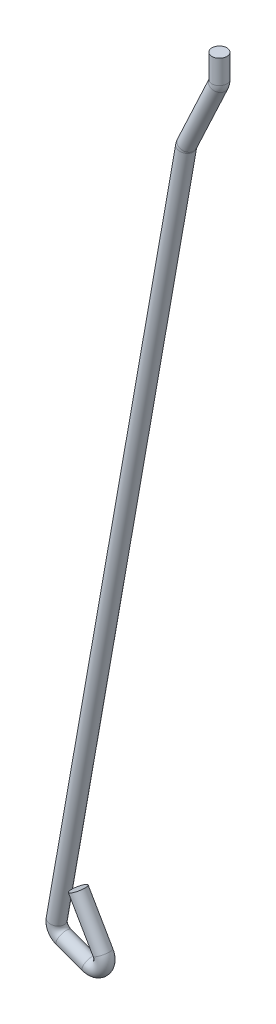
from build123d import *

# Parameters (mm, degrees)
SKETCH2_R = 0.9144


with BuildPart() as part:
    # Sweep3: sweep along a path in Sketch1
    with BuildLine(Plane.XY) as sweep3_path:
        Line((0, 0), (0, -2.893447778))
        ThreePointArc((0, -2.893447778), (-0.030104071, -3.168326088), (-0.11898911, -3.430172971))
        Line((-0.11898911, -3.430172971), (-3.954777731, -11.656048213))
        ThreePointArc((-3.954777731, -11.656048213), (-4.014987369, -11.81087704), (-4.054472688, -11.97224022))
        Line((-4.054472688, -11.97224022), (-19.829045587, -101.434288716))
        ThreePointArc((-19.829045587, -101.434288716), (-19.678192004, -102.289821901), (-19.012705323, -102.84823153))
        Line((-19.012705323, -102.84823153), (-15.83415073, -104.005130789))
        ThreePointArc((-15.83415073, -104.005130789), (-14.426908706, -103.628061425), (-14.299932886, -102.176721161))
        Line((-14.299932886, -102.176721161), (-17.317784724, -96.949648447))
    # Sketch2 → Sweep3 (sweep)
    with BuildSketch(Plane(origin=(0, 0, 0), x_dir=(1, 0, 0), z_dir=(0, 1, 0))):
        with Locations((-0.059494555, 0)):
            Circle(SKETCH2_R)
    sweep(path=sweep3_path.line)


solid = part.part
